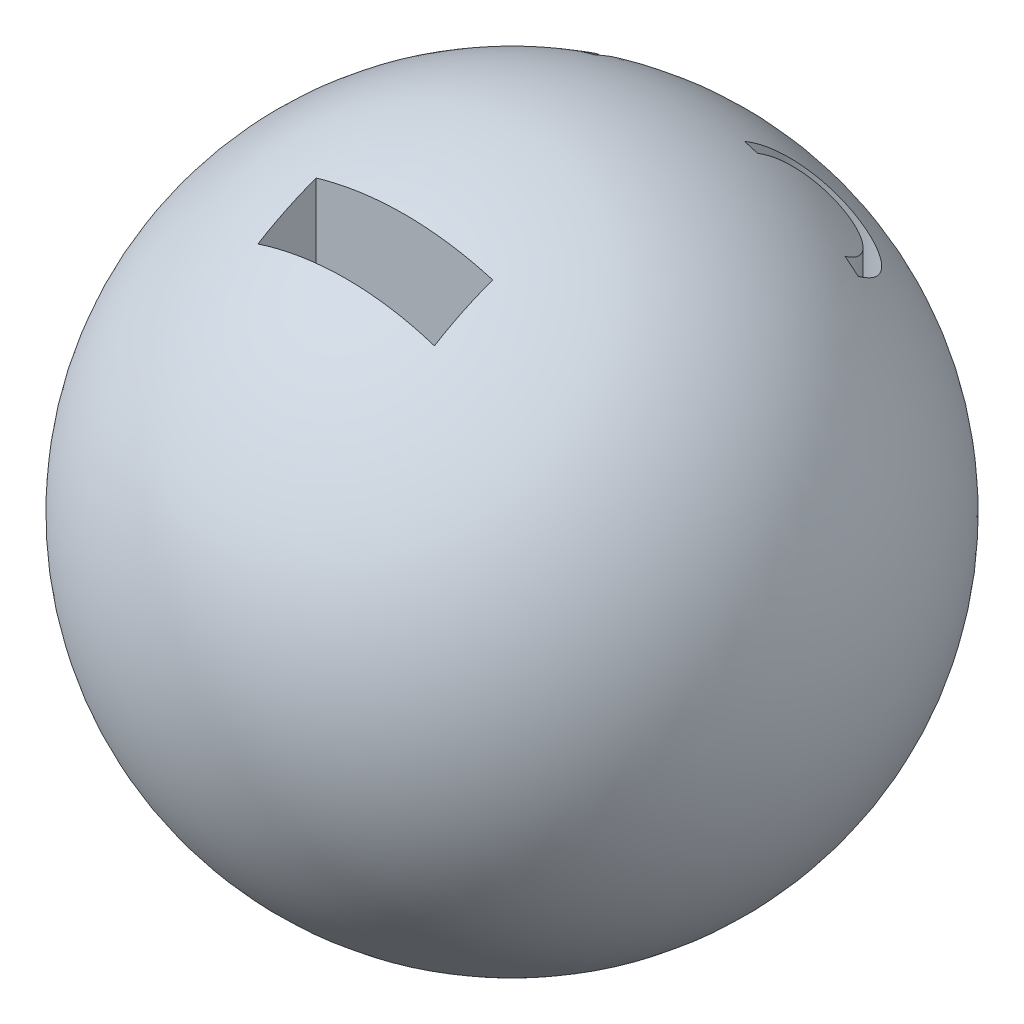
from build123d import *

# Parameters (mm, degrees)
SKETCH_6_W          = 13.38221488
SKETCH_6_H          = 4.41838063
CUT_EXTRUDE_1_DEPTH = 50.749371855


with BuildPart() as part:
    # 草图4 → 旋转1 (revolve)
    with BuildSketch(Plane(origin=(0, 0, 0), x_dir=(0, 0, -1), z_dir=(1, 0, 0))):
        with BuildLine():
            Line((0, -25), (0, 0))
            Line((0, 0), (0, 17.552013601))
            Line((0, 17.552013601), (0, 25))
            ThreePointArc((0, 25), (-25, 0), (0, -25))
        make_face()
    revolve(axis=Axis((0, 0, 0), (0, 1, 0)))

    # 草图6 → 切除-拉伸1 (cut, through all)
    with BuildSketch(Plane(origin=(0, 10, 0), x_dir=(1, 0, 0), z_dir=(0, 1, 0))):
        with BuildLine():
            Line((-14.30889256, 11.940688041), (-13.30889256, 11.940688041))
            ThreePointArc((-13.30889256, 11.940688041), (-10, 15.2495806), (-6.69110744, 11.940688041))
            Line((-6.69110744, 11.940688041), (-5.69110744, 11.940688041))
            ThreePointArc((-5.69110744, 11.940688041), (-10, 16.2495806), (-14.30889256, 11.940688041))
        make_face()
        with Locations((0, -10.364363226)):
            Rectangle(SKETCH_6_W, SKETCH_6_H)
        with BuildLine():
            ThreePointArc((5.69110744, 11.940688041), (10, 16.2495806), (14.30889256, 11.940688041))
            Line((14.30889256, 11.940688041), (13.30889256, 11.940688041))
            ThreePointArc((13.30889256, 11.940688041), (10, 15.2495806), (6.69110744, 11.940688041))
            Line((6.69110744, 11.940688041), (5.69110744, 11.940688041))
        make_face()
    extrude(amount=CUT_EXTRUDE_1_DEPTH, mode=Mode.SUBTRACT)


solid = part.part
